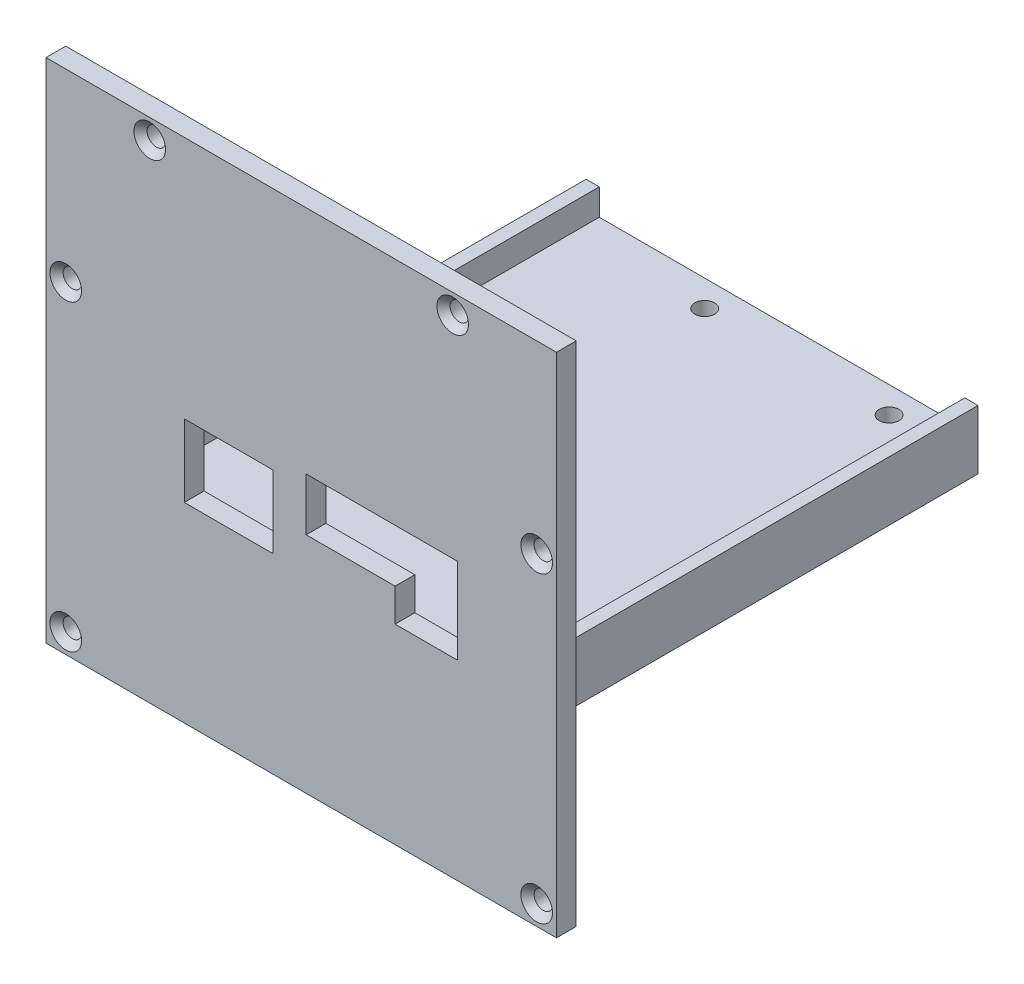
from build123d import *

# Parameters (mm, degrees)
SZKIC1_W                    = 77.5
SZKIC1_H                    = 77
SZKIC1_W_2                  = 13.5
SZKIC1_H_2                  = 11
DODANIE_WYCI_GNI_CIE1_DEPTH = 3
DODANIE_WYCI_GNI_CIE3_DEPTH = 70
SZKIC2_R                    = 1.4
WYTNIJ_WYCI_GNI_CIE1_DEPTH  = 3
SZKIC4_R                    = 1.4
WYTNIJ_WYCI_GNI_CIE2_DEPTH  = 3
SZKIC5_R                    = 1.5
WYTNIJ_WYCI_GNI_CIE3_DEPTH  = 5
SFAZOWANIE1_SIZE            = 1
SFAZOWANIE2_SIZE            = 1
SFAZOWANIE3_SIZE            = 1


with BuildPart() as part:
    # Szkic1 → Dodanie-wyciągnięcie1 (new body)
    with BuildSketch(Plane.XY):
        with Locations((14.670842187, -80.255543912)):
            Rectangle(SZKIC1_W, SZKIC1_H)
        with Locations((3.670842187, -84.255543912)):
            Rectangle(SZKIC1_W_2, SZKIC1_H_2, mode=Mode.SUBTRACT)
        Polygon((15.420842187, -76.755543912), (38.420842187, -76.755543912), (38.420842187, -89.755543912), (28.920842187, -89.755543912), (28.920842187, -84.755543912), (15.420842187, -84.755543912), align=None, mode=Mode.SUBTRACT)
    extrude(amount=DODANIE_WYCI_GNI_CIE1_DEPTH)

    # Szkic1<5> → Dodanie-wyciągnięcie3 (add)
    with BuildSketch(Plane.XY):
        Polygon((42.420842187, -89.755543912), (44.420842187, -89.755543912), (44.420842187, -98.755543912), (-15.079157813, -98.755543912), (-15.079157813, -89.755543912), (-13.079157813, -89.755543912), (-13.079157813, -93.755543912), (42.420842187, -93.755543912), align=None)
    extrude(amount=-DODANIE_WYCI_GNI_CIE3_DEPTH)

    # Szkic2 → Wytnij-wyciągnięcie1 (cut)
    with BuildSketch(Plane.XY.offset(3)):
        with Locations((-8.329157813, -44.755543912)):
            Circle(SZKIC2_R)
        with Locations((37.670842187, -44.755543912)):
            Circle(SZKIC2_R)
    extrude(amount=-WYTNIJ_WYCI_GNI_CIE1_DEPTH, mode=Mode.SUBTRACT)

    # Szkic4 → Wytnij-wyciągnięcie2 (cut)
    with BuildSketch(Plane.XY.offset(3)):
        with Locations((-21.079157813, -69.755543912)):
            Circle(SZKIC4_R)
        with Locations((-21.079157813, -115.755543912)):
            Circle(SZKIC4_R)
        with Locations((50.420842187, -115.755543912)):
            Circle(SZKIC4_R)
        with Locations((50.420842187, -69.755543912)):
            Circle(SZKIC4_R)
    extrude(amount=-WYTNIJ_WYCI_GNI_CIE2_DEPTH, mode=Mode.SUBTRACT)

    # Szkic5 → Wytnij-wyciągnięcie3 (cut)
    with BuildSketch(Plane(origin=(0, -93.755543912, 0), x_dir=(1, 0, 0), z_dir=(0, 1, 0))):
        with Locations(Location((34.920842187, 66, 0), (0, 0, 270))):
            Circle(SZKIC5_R)
        with Locations(Location((6.920842187, 66, 0), (0, 0, 270))):
            Circle(SZKIC5_R)
    extrude(amount=-WYTNIJ_WYCI_GNI_CIE3_DEPTH, mode=Mode.SUBTRACT)

    # Sfazowanie1
    sfazowanie1_edges = [part.edges().sort_by_distance(p)[0] for p in [
        (-9.729157813, -44.755543912, 3),
    ]]
    chamfer(sfazowanie1_edges, length=SFAZOWANIE1_SIZE)

    # Sfazowanie2
    sfazowanie2_edges = [part.edges().sort_by_distance(p)[0] for p in [
        (36.270842187, -44.755543912, 3),
    ]]
    chamfer(sfazowanie2_edges, length=SFAZOWANIE2_SIZE)

    # Sfazowanie3
    sfazowanie3_edges = [part.edges().sort_by_distance(p)[0] for p in [
        (49.020842187, -69.755543912, 3),
        (49.020842187, -115.755543912, 3),
        (-22.479157813, -115.755543912, 3),
        (-22.479157813, -69.755543912, 3),
    ]]
    chamfer(sfazowanie3_edges, length=SFAZOWANIE3_SIZE)


solid = part.part
